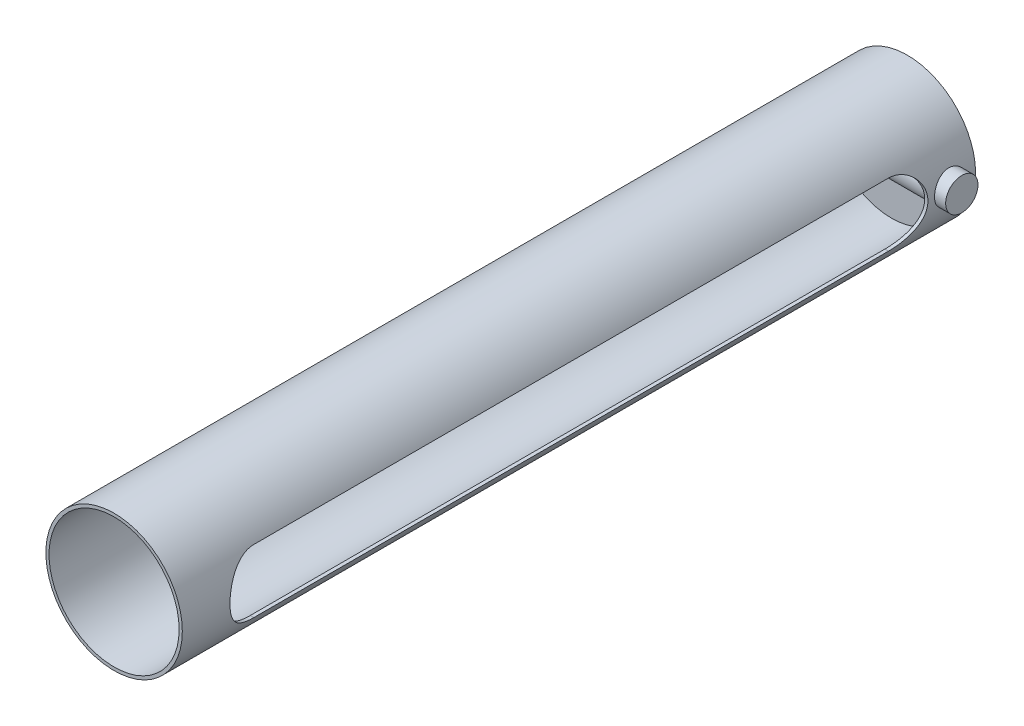
from build123d import *

# Parameters (mm, degrees)
SKETCH1_R           = 10.922
BOSS_EXTRUDE1_DEPTH = 127
SKETCH2_R           = 10.414
CUT_EXTRUDE1_DEPTH  = 124.46
CUT_EXTRUDE2_DEPTH  = 15.24
SKETCH5_R           = 2.590245468
BOSS_EXTRUDE2_DEPTH = 12.7


with BuildPart() as part:
    # Sketch1 → Boss-Extrude1 (new body)
    with BuildSketch(Plane.XY):
        Circle(SKETCH1_R)
    extrude(amount=BOSS_EXTRUDE1_DEPTH)

    # Sketch2 → Cut-Extrude1 (cut)
    with BuildSketch(Plane.XY.offset(127)):
        Circle(SKETCH2_R)
    extrude(amount=-CUT_EXTRUDE1_DEPTH, mode=Mode.SUBTRACT)

    # Sketch4 → Cut-Extrude2 (cut)
    with BuildSketch(Plane(origin=(0, 0, 0), x_dir=(0, 0, -1), z_dir=(1, 0, 0))):
        with BuildLine():
            Line((-114.3, 5.067588244), (-12.7, 5.067588244))
            ThreePointArc((-12.7, 5.067588244), (-7.632411756, 0), (-12.7, -5.067588244))
            Line((-12.7, -5.067588244), (-114.3, -5.067588244))
            ThreePointArc((-114.3, -5.067588244), (-119.367588244, 0), (-114.3, 5.067588244))
        make_face()
    extrude(amount=CUT_EXTRUDE2_DEPTH, mode=Mode.SUBTRACT)

    # Sketch5 → Boss-Extrude2 (add)
    with BuildSketch(Plane(origin=(0, 0, 0), x_dir=(0, 0, -1), z_dir=(1, 0, 0))):
        with Locations((-3.984592514, 0)):
            Circle(SKETCH5_R)
    extrude(amount=BOSS_EXTRUDE2_DEPTH)


solid = part.part
